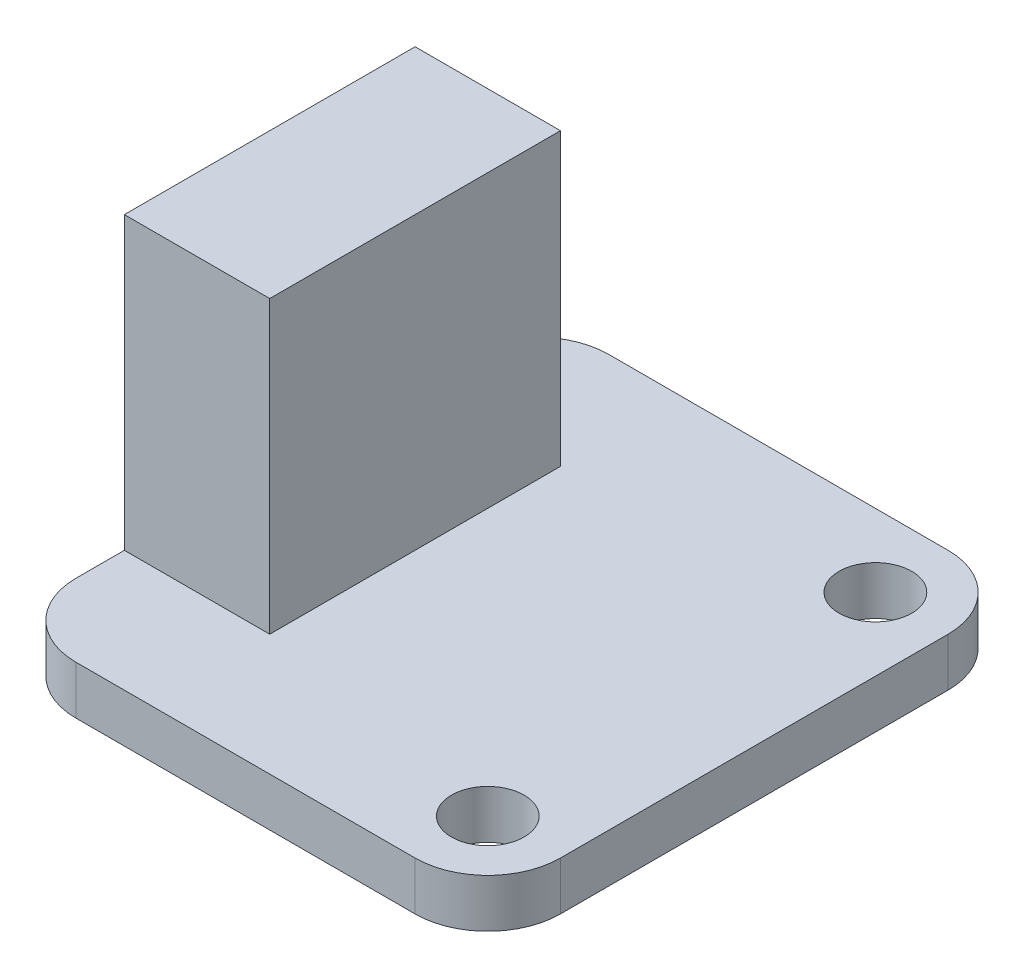
from build123d import *

# Parameters (mm, degrees)
SKETCH1_R           = 1.5
BOSS_EXTRUDE1_DEPTH = 2
SKETCH2_W           = 6
SKETCH2_H           = 12
BOSS_EXTRUDE2_DEPTH = 12
SKETCH3_W           = 2
SKETCH3_H           = 4
BOSS_EXTRUDE3_DEPTH = 2


with BuildPart() as part:
    # Sketch1 → Boss-Extrude1 (new body)
    with BuildSketch(Plane(origin=(0, 0, 0), x_dir=(1, 0, 0), z_dir=(0, 1, 0))):
        with BuildLine():
            Line((-7, 11), (7, 11))
            ThreePointArc((7, 11), (9.121320344, 10.121320344), (10, 8))
            Line((10, 8), (10, -8))
            ThreePointArc((10, -8), (9.121320344, -10.121320344), (7, -11))
            Line((7, -11), (-7, -11))
            ThreePointArc((-7, -11), (-9.121320344, -10.121320344), (-10, -8))
            Line((-10, -8), (-10, 8))
            ThreePointArc((-10, 8), (-9.121320344, 10.121320344), (-7, 11))
        make_face()
        with Locations(Location((7, 8, 0), (0, 0, 270))):
            Circle(SKETCH1_R, mode=Mode.SUBTRACT)
        with Locations(Location((7, -8, 0), (0, 0, 270))):
            Circle(SKETCH1_R, mode=Mode.SUBTRACT)
    extrude(amount=BOSS_EXTRUDE1_DEPTH)

    # Sketch2 → Boss-Extrude2 (add)
    with BuildSketch(Plane(origin=(0, 2, 0), x_dir=(1, 0, 0), z_dir=(0, 1, 0))):
        with Locations((-7, 0)):
            Rectangle(SKETCH2_W, SKETCH2_H)
    extrude(amount=BOSS_EXTRUDE2_DEPTH)

    # Sketch3 → Boss-Extrude3 (add)
    with BuildSketch(Plane.XZ):
        with Locations((2, 0)):
            Rectangle(SKETCH3_W, SKETCH3_H)
    extrude(amount=BOSS_EXTRUDE3_DEPTH)


solid = part.part
